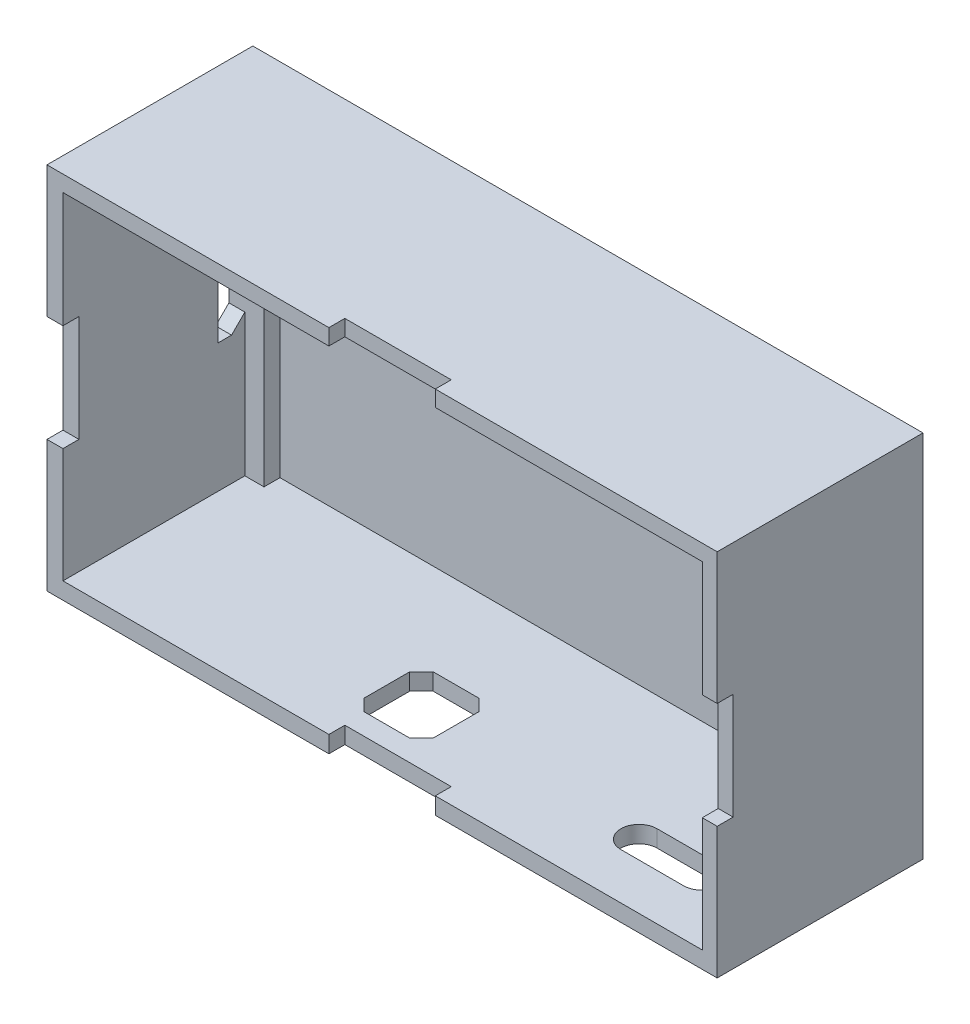
from build123d import *

# Parameters (mm, degrees)
CROQUIS1_W              = 58.2
CROQUIS1_H              = 31.7
CROQUIS1_R              = 1.55
SALIENTE_EXTRUIR1_DEPTH = 0.75
CROQUIS3_W              = 63
CROQUIS3_H              = 34.7
CROQUIS3_W_2            = 58.2
CROQUIS3_H_2            = 31.7
SALIENTE_EXTRUIR2_DEPTH = 2.25
CROQUIS4_W              = 63
CROQUIS4_H              = 34.7
CROQUIS4_W_2            = 60
CROQUIS4_H_2            = 31.619362532
SALIENTE_EXTRUIR3_DEPTH = 9.35
CROQUIS5_W              = 0.932931466
CROQUIS5_H              = 31.619362532
CORTAR_EXTRUIR1_DEPTH   = 10
CROQUIS6_W              = 0.932931466
CROQUIS6_H              = 31.619362532
SALIENTE_EXTRUIR4_DEPTH = 0.75
CROQUIS7_W              = 6.3
CROQUIS7_H              = 3.1
CORTAR_EXTRUIR2_DEPTH   = 10
CROQUIS9_W              = 63
CROQUIS9_H              = 34.7
CROQUIS9_W_2            = 60.1
CROQUIS9_H_2            = 31.619362532
SALIENTE_EXTRUIR5_DEPTH = 10
CROQUIS10_W             = 6.5
CROQUIS10_H             = 6.5
CORTAR_EXTRUIR3_DEPTH   = 10
CORTAR_EXTRUIR4_DEPTH   = 10
CROQUIS12_W             = 0.4
CROQUIS12_H             = 3.1
SALIENTE_EXTRUIR6_DEPTH = 1.580637468
CORTAR_EXTRUIR5_DEPTH   = 10
SALIENTE_EXTRUIR7_DEPTH = 1.580637468
CROQUIS15_W             = 63
CROQUIS15_H             = 34.7
SALIENTE_EXTRUIR8_DEPTH = 0.75
CORTAR_EXTRUIR6_DEPTH   = 1.5
CORTAR_EXTRUIR8_DEPTH   = 10
SALIENTE_EXTRUIR9_DEPTH = 1.5
CORTAR_EXTRUIR9_DEPTH   = 10


with BuildPart() as part:
    # Croquis1 → Saliente-Extruir1 (new body)
    with BuildSketch(Plane.XY):
        with Locations((5.077191095, -8.199822064)):
            Rectangle(CROQUIS1_W, CROQUIS1_H)
        with Locations((-20.872808905, 4.450177936)):
            Circle(CROQUIS1_R, mode=Mode.SUBTRACT)
        with Locations((31.027191095, 4.450177936)):
            Circle(CROQUIS1_R, mode=Mode.SUBTRACT)
        with Locations((-20.872808905, -20.849822064)):
            Circle(CROQUIS1_R, mode=Mode.SUBTRACT)
        with Locations((31.027191095, -20.849822064)):
            Circle(CROQUIS1_R, mode=Mode.SUBTRACT)
    extrude(amount=SALIENTE_EXTRUIR1_DEPTH)

    # Croquis3 → Saliente-Extruir2 (add)
    with BuildSketch(Plane(origin=(0, 0, 0), x_dir=(-1, 0, 0), z_dir=(0, 0, -1))):
        with Locations((-4.177191095, -8.199822064)):
            Rectangle(CROQUIS3_W, CROQUIS3_H)
        with Locations((-5.077191095, -8.199822064)):
            Rectangle(CROQUIS3_W_2, CROQUIS3_H_2, mode=Mode.SUBTRACT)
    extrude(amount=-SALIENTE_EXTRUIR2_DEPTH)

    # Croquis4 → Saliente-Extruir3 (add)
    with BuildSketch(Plane.XY):
        with Locations((4.177191095, -8.199822064)):
            Rectangle(CROQUIS4_W, CROQUIS4_H)
        with Locations((4.177191095, -8.15950333)):
            Rectangle(CROQUIS4_W_2, CROQUIS4_H_2, mode=Mode.SUBTRACT)
    extrude(amount=SALIENTE_EXTRUIR3_DEPTH)

    # Croquis5 → Cortar-Extruir1 (cut)
    with BuildSketch(Plane.XY):
        with Locations((33.810725362, -8.15950333)):
            Rectangle(CROQUIS5_W, CROQUIS5_H)
    extrude(amount=CORTAR_EXTRUIR1_DEPTH, mode=Mode.SUBTRACT)

    # Croquis6 → Saliente-Extruir4 (add)
    with BuildSketch(Plane(origin=(0, 0, 0), x_dir=(-1, 0, 0), z_dir=(0, 0, -1))):
        with Locations((-33.810725362, -8.15950333)):
            Rectangle(CROQUIS6_W, CROQUIS6_H)
    extrude(amount=-SALIENTE_EXTRUIR4_DEPTH)

    # Croquis7 → Cortar-Extruir2 (cut)
    with BuildSketch(Plane(origin=(0, -23.969184596, 0), x_dir=(1, 0, 0), z_dir=(0, 1, 0))):
        with Locations((27.127191095, -6.8)):
            Rectangle(CROQUIS7_W, CROQUIS7_H)
    extrude(amount=-CORTAR_EXTRUIR2_DEPTH, mode=Mode.SUBTRACT)

    # Croquis9 → Saliente-Extruir5 (add)
    with BuildSketch(Plane.XY.offset(9.35)):
        with Locations((4.177191095, -8.199822064)):
            Rectangle(CROQUIS9_W, CROQUIS9_H)
        with Locations((4.227191095, -8.15950333)):
            Rectangle(CROQUIS9_W_2, CROQUIS9_H_2, mode=Mode.SUBTRACT)
    extrude(amount=SALIENTE_EXTRUIR5_DEPTH)

    # Croquis10 → Cortar-Extruir3 (cut)
    with BuildSketch(Plane(origin=(0, -23.969184596, 0), x_dir=(1, 0, 0), z_dir=(0, 1, 0))):
        with Locations((1.127191095, -12.6)):
            Rectangle(CROQUIS10_W, CROQUIS10_H)
    extrude(amount=-CORTAR_EXTRUIR3_DEPTH, mode=Mode.SUBTRACT)

    # Croquis11 → Cortar-Extruir4 (cut)
    with BuildSketch(Plane(origin=(0, -23.969184596, 0), x_dir=(1, 0, 0), z_dir=(0, 1, 0))):
        with BuildLine():
            Line((22.277191095, -11.7), (28.177191095, -11.7))
            ThreePointArc((28.177191095, -11.7), (29.777191095, -13.3), (28.177191095, -14.9))
            Line((28.177191095, -14.9), (22.277191095, -14.9))
            ThreePointArc((22.277191095, -14.9), (20.677191095, -13.3), (22.277191095, -11.7))
        make_face()
    extrude(amount=-CORTAR_EXTRUIR4_DEPTH, mode=Mode.SUBTRACT)

    # Croquis12 → Saliente-Extruir6 (add)
    with BuildSketch(Plane.XZ.offset(25.549822064)):
        with Locations((24.177191095, 6.8)):
            Rectangle(CROQUIS12_W, CROQUIS12_H)
    extrude(amount=-SALIENTE_EXTRUIR6_DEPTH)

    # Croquis13 → Cortar-Extruir5 (cut)
    with BuildSketch(Plane(origin=(-25.822808905, 0, 0), x_dir=(0, 0, -1), z_dir=(1, 0, 0))):
        Polygon((-6.25, -4.434822064), (-5, -4.434822064), (-3.75, -5.684822064), (-3.75, -10.634822064), (-5, -11.884822064), (-6.25, -11.884822064), align=None)
    extrude(amount=-CORTAR_EXTRUIR5_DEPTH, mode=Mode.SUBTRACT)

    # Croquis14 → Saliente-Extruir7 (add)
    with BuildSketch(Plane.XZ.offset(25.549822064)):
        Polygon((4.377191095, 10.45), (3.277191095, 9.35), (4.377191095, 9.35), align=None)
        Polygon((-1.022808905, 9.35), (-2.122808905, 10.45), (-2.122808905, 9.35), align=None)
        Polygon((-2.122808905, 14.75), (-1.022808905, 15.85), (-2.122808905, 15.85), align=None)
        Polygon((3.277191095, 15.85), (4.377191095, 14.75), (4.377191095, 15.85), align=None)
    extrude(amount=-SALIENTE_EXTRUIR7_DEPTH)

    # Croquis15 → Saliente-Extruir8 (add)
    with BuildSketch(Plane(origin=(0, 0, 0), x_dir=(-1, 0, 0), z_dir=(0, 0, -1))):
        with Locations((-4.177191095, -8.199822064)):
            Rectangle(CROQUIS15_W, CROQUIS15_H)
    extrude(amount=-SALIENTE_EXTRUIR8_DEPTH)

    # Croquis16 → Cortar-Extruir6 (cut)
    with BuildSketch(Plane.XY.offset(19.35)):
        Polygon((-32.290822341, -3.199822064), (-0.822808905, -3.199822064), (-0.822808905, 14.947745762), (9.177191095, 14.947745762), (9.177191095, -3.199822064), (49.10392573, -3.199822064), (49.10392573, -13.199822064), (9.177191095, -13.199822064), (9.177191095, -34.683452232), (-0.822808905, -34.683452232), (-0.822808905, -13.199822064), (-32.290822341, -13.199822064), align=None)
    extrude(amount=-CORTAR_EXTRUIR6_DEPTH, mode=Mode.SUBTRACT)

    # Croquis17 → Cortar-Extruir8 (cut)
    with BuildSketch(Plane.XZ.offset(25.549822064)):
        with BuildLine():
            Line((22.277191095, 15), (28.177191095, 15))
            ThreePointArc((28.177191095, 15), (29.877191095, 13.3), (28.177191095, 11.6))
            Line((28.177191095, 11.6), (22.277191095, 11.6))
            ThreePointArc((22.277191095, 11.6), (20.577191095, 13.3), (22.277191095, 15))
        make_face()
    extrude(amount=-CORTAR_EXTRUIR8_DEPTH, mode=Mode.SUBTRACT)

    # Croquis22 → Saliente-Extruir9 (add)
    with BuildSketch(Plane.ZY.offset(27.322808905)):
        Polygon((6.25, -4.434822064), (6.25, -11.884822064), (5, -11.884822064), (3.75, -10.634822064), (3.75, -5.684822064), (5, -4.434822064), align=None)
    extrude(amount=-SALIENTE_EXTRUIR9_DEPTH)

    # Croquis24 → Cortar-Extruir9 (cut)
    with BuildSketch(Plane(origin=(-25.822808905, 0, 0), x_dir=(0, 0, -1), z_dir=(1, 0, 0))):
        Polygon((-2.25, -5.684822064), (-2.25, -10.634822064), (-3.501579003, -11.886401067), (-4.751579003, -11.886401067), (-4.751579003, -4.433243061), (-3.501579003, -4.433243061), align=None)
    extrude(amount=-CORTAR_EXTRUIR9_DEPTH, mode=Mode.SUBTRACT)


solid = part.part
